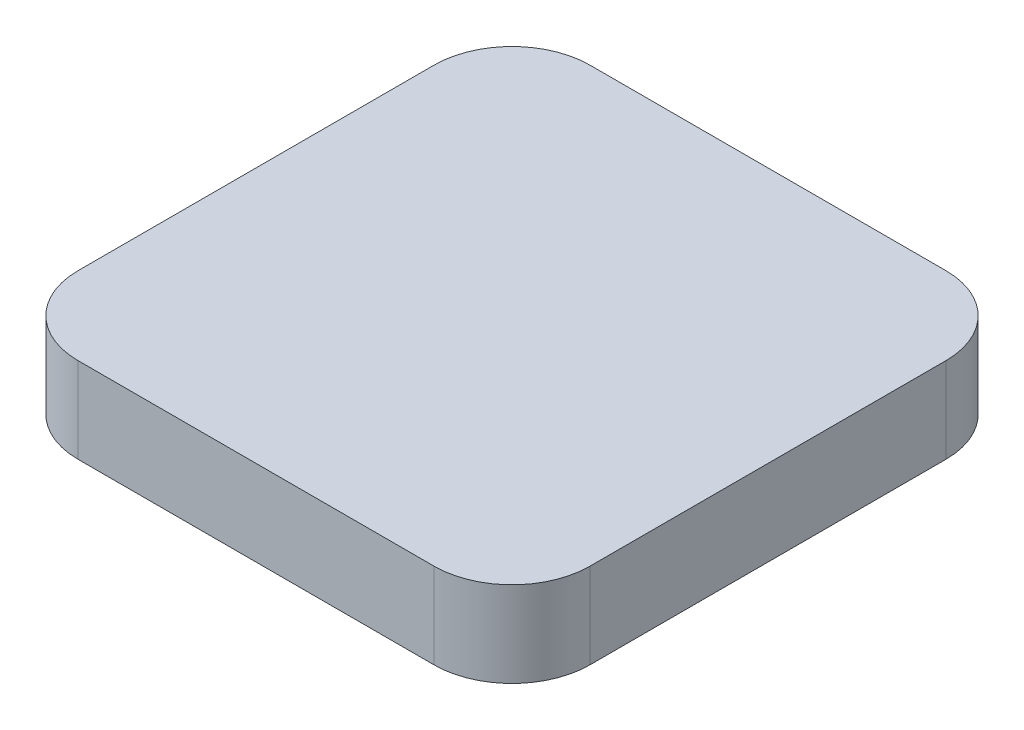
from build123d import *

# Parameters (mm, degrees)
BOSS_EXTRUDE1_DEPTH = 4.1783


with BuildPart() as part:
    # Sketch1 → Boss-Extrude1 (new body)
    with BuildSketch(Plane(origin=(0, 0, 0), x_dir=(1, 0, 0), z_dir=(0, 1, 0))):
        with BuildLine():
            Line((-8.6995, -12.5095), (8.6995, -12.5095))
            ThreePointArc((8.6995, -12.5095), (11.393576836, -11.393576836), (12.5095, -8.6995))
            Line((12.5095, -8.6995), (12.5095, 8.6995))
            ThreePointArc((12.5095, 8.6995), (11.393576836, 11.393576836), (8.6995, 12.5095))
            Line((8.6995, 12.5095), (-8.6995, 12.5095))
            ThreePointArc((-8.6995, 12.5095), (-11.393576836, 11.393576836), (-12.5095, 8.6995))
            Line((-12.5095, 8.6995), (-12.5095, -8.6995))
            ThreePointArc((-12.5095, -8.6995), (-11.393576836, -11.393576836), (-8.6995, -12.5095))
        make_face()
    extrude(amount=BOSS_EXTRUDE1_DEPTH)


solid = part.part
